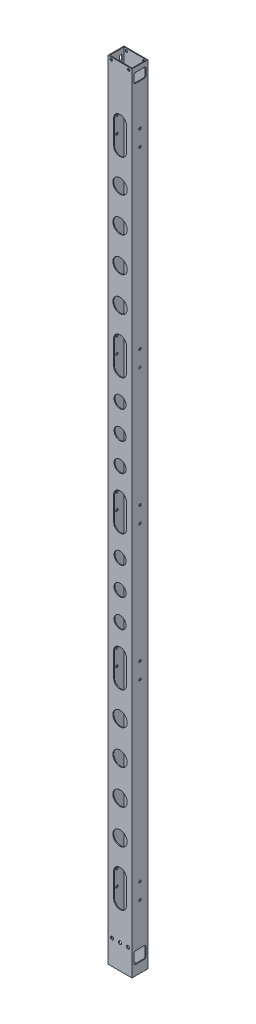
from build123d import *

# Parameters (mm, degrees)
SKETCH_1_W           = 30
SKETCH_1_H           = 20
SKETCH_1_W_2         = 28
SKETCH_1_H_2         = 18
EXTRUDE_1_DEPTH      = 980
SKETCH_3_R           = 1.5
CUT_EXTRUDE_2_DEPTH  = 981.51007134
CUT_EXTRUDE_3_DEPTH  = 981.51007134
SKETCH_5_W           = 15
SKETCH_5_H           = 12
CUT_EXTRUDE_4_DEPTH  = 10
SKETCH_6_R           = 9
SKETCH_6_R_2         = 7.5
CUT_EXTRUDE_5_DEPTH  = 981.318825689
SKETCH_9_R           = 1.5
CUT_EXTRUDE_7_DEPTH  = 981.318825689
SKETCH_13_W          = 30
SKETCH_13_H          = 20
SKETCH_13_W_2        = 28
SKETCH_13_H_2        = 18
EXTRUDE_2_DEPTH      = 10
CUT_EXTRUDE_8_DEPTH  = 60
SKETCH_15_W          = 15
SKETCH_15_H          = 15
CUT_EXTRUDE_10_DEPTH = 5
FILLET_1_R           = 2
SKETCH_16_R          = 2
CUT_EXTRUDE_11_DEPTH = 90
FILLET_2_R           = 2


with BuildPart() as part:
    # 草图1 → 凸台-拉伸1 (new body)
    with BuildSketch(Plane(origin=(0, 0, 0), x_dir=(1, 0, 0), z_dir=(0, 1, 0))):
        Rectangle(SKETCH_1_W, SKETCH_1_H)
        Rectangle(SKETCH_1_W_2, SKETCH_1_H_2, mode=Mode.SUBTRACT)
    extrude(amount=EXTRUDE_1_DEPTH)

    # 草图3 → 切除-拉伸2 (cut, through all)
    with BuildSketch(Plane(origin=(15, 0, 0), x_dir=(0, 0, -1), z_dir=(1, 0, 0))):
        with Locations((0, 890)):
            Circle(SKETCH_3_R)
        with Locations((0, 910)):
            Circle(SKETCH_3_R)
        with Locations((0, 500)):
            Circle(SKETCH_3_R)
        with Locations((0, 480)):
            Circle(SKETCH_3_R)
        with Locations((0, 670)):
            Circle(SKETCH_3_R)
        with Locations((0, 650)):
            Circle(SKETCH_3_R)
        with Locations((0, 330)):
            Circle(SKETCH_3_R)
        with Locations((0, 310)):
            Circle(SKETCH_3_R)
        with Locations((0, 70)):
            Circle(SKETCH_3_R)
        with Locations((0, 90)):
            Circle(SKETCH_3_R)
    extrude(amount=-CUT_EXTRUDE_2_DEPTH, mode=Mode.SUBTRACT)

    # 草图4 → 切除-拉伸3 (cut, through all)
    with BuildSketch(Plane(origin=(15, 0, 0), x_dir=(0, 0, -1), z_dir=(1, 0, 0))):
        with BuildLine():
            Line((3.4, 968), (3.4, 972))
            ThreePointArc((3.4, 972), (5, 973.6), (6.6, 972))
            Line((6.6, 972), (6.6, 968))
            ThreePointArc((6.6, 968), (5, 966.4), (3.4, 968))
        make_face()
        with BuildLine():
            Line((-3.4, 968), (-3.4, 972))
            ThreePointArc((-3.4, 972), (-5, 973.6), (-6.6, 972))
            Line((-6.6, 972), (-6.6, 968))
            ThreePointArc((-6.6, 968), (-5, 966.4), (-3.4, 968))
        make_face()
    extrude(amount=-CUT_EXTRUDE_3_DEPTH, mode=Mode.SUBTRACT)

    # 草图5 → 切除-拉伸4 (cut)
    with BuildSketch(Plane(origin=(15, 0, 0), x_dir=(0, 0, -1), z_dir=(1, 0, 0))):
        with Locations((0, 968)):
            Rectangle(SKETCH_5_W, SKETCH_5_H)
    extrude(amount=-CUT_EXTRUDE_4_DEPTH, mode=Mode.SUBTRACT)

    # 草图6 → 切除-拉伸5 (cut, through all)
    with BuildSketch(Plane(origin=(0, 0, -10), x_dir=(-1, 0, 0), z_dir=(0, 0, -1))):
        with Locations((0, 135)):
            Circle(SKETCH_6_R)
        with Locations((0, 178.333333333)):
            Circle(SKETCH_6_R)
        with Locations((0, 221.666666667)):
            Circle(SKETCH_6_R)
        with Locations((0, 265)):
            Circle(SKETCH_6_R)
        with Locations((0, 845)):
            Circle(SKETCH_6_R)
        with Locations((0, 801.666666667)):
            Circle(SKETCH_6_R)
        with Locations((0, 758.333333333)):
            Circle(SKETCH_6_R)
        with Locations((0, 715)):
            Circle(SKETCH_6_R)
        with Locations((0, 440)):
            Circle(SKETCH_6_R_2)
        with Locations((0, 405)):
            Circle(SKETCH_6_R_2)
        with Locations((0, 370)):
            Circle(SKETCH_6_R_2)
        with Locations((0, 610)):
            Circle(SKETCH_6_R_2)
        with Locations((0, 575)):
            Circle(SKETCH_6_R_2)
        with Locations((0, 540)):
            Circle(SKETCH_6_R_2)
        with BuildLine():
            Line((-8, 65), (-8, 95))
            ThreePointArc((-8, 95), (0, 103), (8, 95))
            Line((8, 95), (8, 65))
            ThreePointArc((8, 65), (0, 57), (-8, 65))
        make_face()
        with BuildLine():
            Line((-8, 305), (-8, 335))
            ThreePointArc((-8, 335), (0, 343), (8, 335))
            Line((8, 335), (8, 305))
            ThreePointArc((8, 305), (0, 297), (-8, 305))
        make_face()
        with BuildLine():
            Line((-8, 475), (-8, 505))
            ThreePointArc((-8, 505), (0, 513), (8, 505))
            Line((8, 505), (8, 475))
            ThreePointArc((8, 475), (0, 467), (-8, 475))
        make_face()
        with BuildLine():
            Line((-8, 645), (-8, 675))
            ThreePointArc((-8, 675), (0, 683), (8, 675))
            Line((8, 675), (8, 645))
            ThreePointArc((8, 645), (0, 637), (-8, 645))
        make_face()
        with BuildLine():
            Line((-8, 885), (-8, 915))
            ThreePointArc((-8, 915), (0, 923), (8, 915))
            Line((8, 915), (8, 885))
            ThreePointArc((8, 885), (0, 877), (-8, 885))
        make_face()
    extrude(amount=-CUT_EXTRUDE_5_DEPTH, mode=Mode.SUBTRACT)

    # 草图9 → 切除-拉伸7 (cut, through all)
    with BuildSketch(Plane.XY.offset(10)):
        with Locations((11, 977)):
            Circle(SKETCH_9_R)
        with Locations(Location((-11, 977, 0), (0, 0, 180))):
            Circle(SKETCH_9_R)
    extrude(amount=-CUT_EXTRUDE_7_DEPTH, mode=Mode.SUBTRACT)

    # 草图13 → 凸台-拉伸2 (add)
    with BuildSketch(Plane.XZ):
        Rectangle(SKETCH_13_W, SKETCH_13_H)
        Rectangle(SKETCH_13_W_2, SKETCH_13_H_2, mode=Mode.SUBTRACT)
    extrude(amount=EXTRUDE_2_DEPTH)

    # 草图11 → 切除-拉伸8 (cut)
    with BuildSketch(Plane(origin=(-14, 0, 0), x_dir=(0, 0, -1), z_dir=(1, 0, 0))):
        with BuildLine():
            Line((-6.6, 5), (-6.6, 15))
            ThreePointArc((-6.6, 15), (-5, 16.6), (-3.4, 15))
            Line((-3.4, 15), (-3.4, 5))
            ThreePointArc((-3.4, 5), (-5, 3.4), (-6.6, 5))
        make_face()
        with BuildLine():
            Line((6.6, 5), (6.6, 15))
            ThreePointArc((6.6, 15), (5, 16.6), (3.4, 15))
            Line((3.4, 15), (3.4, 5))
            ThreePointArc((3.4, 5), (5, 3.4), (6.6, 5))
        make_face()
    extrude(amount=-CUT_EXTRUDE_8_DEPTH, mode=Mode.SUBTRACT)

    # 草图15 → 切除-拉伸10 (cut)
    with BuildSketch(Plane(origin=(15, 0, 0), x_dir=(0, 0, -1), z_dir=(1, 0, 0))):
        with Locations((0, 10)):
            Rectangle(SKETCH_15_W, SKETCH_15_H)
    extrude(amount=-CUT_EXTRUDE_10_DEPTH, mode=Mode.SUBTRACT)

    # 圆角1
    fillet_1_edges = [part.edges().sort_by_distance(p)[0] for p in [
        (14.5, 17.5, -7.5),
        (14.5, 2.5, -7.5),
        (14.5, 2.5, 7.5),
        (14.5, 17.5, 7.5),
    ]]
    fillet(fillet_1_edges, radius=FILLET_1_R)

    # 草图16 → 切除-拉伸11 (cut)
    with BuildSketch(Plane.XY.offset(10)):
        with Locations((10, 21)):
            Circle(SKETCH_16_R)
        with Locations((0, 21)):
            Circle(SKETCH_16_R)
        with Locations((-10, 21)):
            Circle(SKETCH_16_R)
    extrude(amount=-CUT_EXTRUDE_11_DEPTH, mode=Mode.SUBTRACT)

    # 圆角2
    fillet_2_edges = [part.edges().sort_by_distance(p)[0] for p in [
        (14.5, 974, -7.5),
        (14.5, 962, -7.5),
        (14.5, 962, 7.5),
        (14.5, 974, 7.5),
    ]]
    fillet(fillet_2_edges, radius=FILLET_2_R)


solid = part.part
